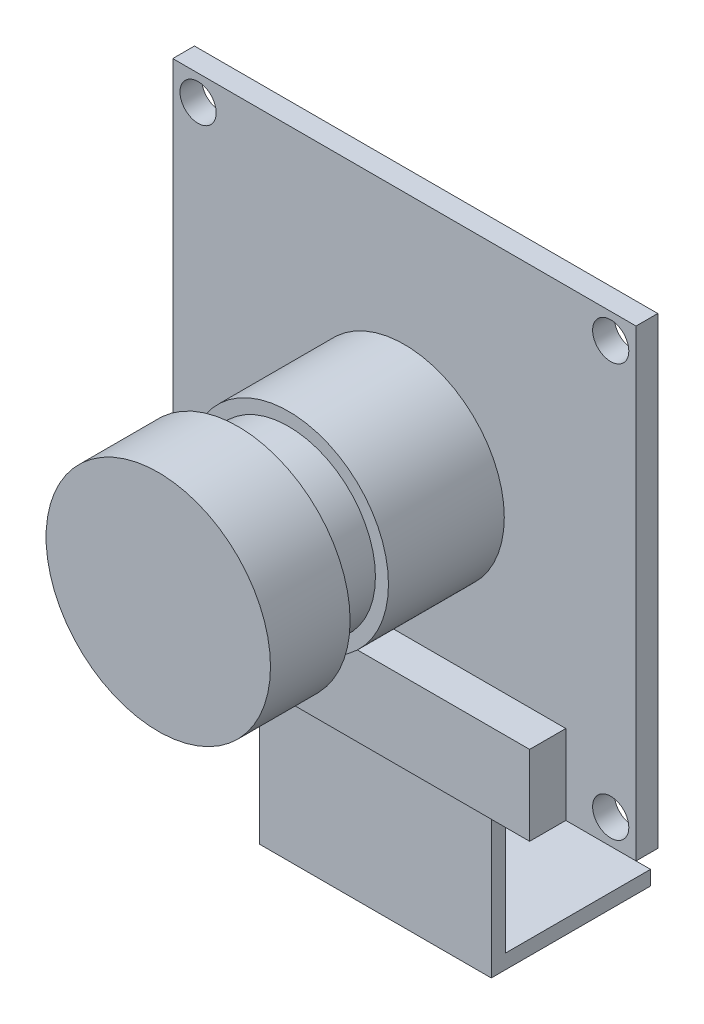
from build123d import *

# Parameters (mm, degrees)
SKETCH_1_W         = 32
SKETCH_1_H         = 32
SKETCH_1_R         = 1.25
EXTRUDE_1463_DEPTH = 1.5
EXTRUDE_START      = 1.5
SKETCH_1_3_W       = 22.3
SKETCH_1_3_H       = 5.5
EXTRUDE_1638_DEPTH = 2.5
SKETCH_1_4_R       = 6.9
SKETCH_1_4_R_2     = 6
EXTRUDE_1808_DEPTH = 8
EXTRUDE_START_2    = 9.5
SKETCH_1_5_R       = 6
EXTRUDE_1980_DEPTH = 3.5
EXTRUDE_START_3    = 13
SKETCH_1_6_R       = 7.75
SKETCH_1_6_R_2     = 6.9
SKETCH_1_6_R_3     = 6
EXTRUDE_2074_DEPTH = 5.5
SKETCH_1_7_R       = 1.5
EXTRUDE_2255_DEPTH = 0.5
SKETCH_2_W         = 16
SKETCH_2_H         = 1
EXTRUDE_2715_DEPTH = 10
SKETCH_3_W         = 16
SKETCH_3_H         = 1
EXTRUDE_3012_DEPTH = 10


with BuildPart() as part:
    # Эскиз1 → Extrude 1463 (new body)
    with BuildSketch(Plane.XY):
        Rectangle(SKETCH_1_W, SKETCH_1_H)
        with Locations((-14.25, -14.25)):
            Circle(SKETCH_1_R, mode=Mode.SUBTRACT)
        with Locations((14.25, -14.25)):
            Circle(SKETCH_1_R, mode=Mode.SUBTRACT)
        with Locations((-14.25, 14.25)):
            Circle(SKETCH_1_R, mode=Mode.SUBTRACT)
        with Locations((14.25, 14.25)):
            Circle(SKETCH_1_R, mode=Mode.SUBTRACT)
    extrude(amount=EXTRUDE_1463_DEPTH)

    # Эскиз1<3> → Extrude 1638 (add)
    with BuildSketch(Plane.XY.offset(EXTRUDE_START)):
        with Locations((0, -13.25)):
            Rectangle(SKETCH_1_3_W, SKETCH_1_3_H)
    extrude(amount=EXTRUDE_1638_DEPTH)

    # Эскиз1<4> → Extrude 1808 (add)
    # profile 1 of 2: a face of its own
    with BuildSketch(Plane.XY.offset(EXTRUDE_START)):
        Circle(SKETCH_1_4_R)
        Circle(SKETCH_1_4_R_2, mode=Mode.SUBTRACT)
    # profile 2 of 2: a face of its own
    with BuildSketch(Plane.XY.offset(EXTRUDE_START)):
        Circle(SKETCH_1_4_R_2)
    extrude(amount=EXTRUDE_1808_DEPTH)

    # Эскиз1<5> → Extrude 1980 (add)
    with BuildSketch(Plane.XY.offset(EXTRUDE_START_2)):
        Circle(SKETCH_1_5_R)
    extrude(amount=EXTRUDE_1980_DEPTH)

    # Эскиз1<6> → Extrude 2074 (add)
    # profile 1 of 3: a face of its own
    with BuildSketch(Plane.XY.offset(EXTRUDE_START_3)):
        Circle(SKETCH_1_6_R)
        Circle(SKETCH_1_6_R_2, mode=Mode.SUBTRACT)
    # profile 2 of 3: a face of its own
    with BuildSketch(Plane.XY.offset(EXTRUDE_START_3)):
        Circle(SKETCH_1_6_R_2)
        Circle(SKETCH_1_6_R_3, mode=Mode.SUBTRACT)
    # profile 3 of 3: a face of its own
    with BuildSketch(Plane.XY.offset(EXTRUDE_START_3)):
        Circle(SKETCH_1_6_R_3)
    extrude(amount=EXTRUDE_2074_DEPTH)

    # Эскиз1<7> → Extrude 2255 (add)
    with BuildSketch(Plane.XY):
        with Locations((9.5, 0)):
            Circle(SKETCH_1_7_R)
        with Locations((-9.5, 0)):
            Circle(SKETCH_1_7_R)
    extrude(amount=-EXTRUDE_2255_DEPTH)

    # Эскиз2 → Extrude 2715 (add)
    with BuildSketch(Plane.XZ.offset(16)):
        with Locations((0, 3)):
            Rectangle(SKETCH_2_W, SKETCH_2_H)
    extrude(amount=EXTRUDE_2715_DEPTH)

    # Эскиз3 → Extrude 3012 (add)
    with BuildSketch(Plane(origin=(0, 0, 2.5), x_dir=(-1, 0, 0), z_dir=(0, 0, -1))):
        with Locations((0, -25.5)):
            Rectangle(SKETCH_3_W, SKETCH_3_H)
    extrude(amount=EXTRUDE_3012_DEPTH)


solid = part.part
